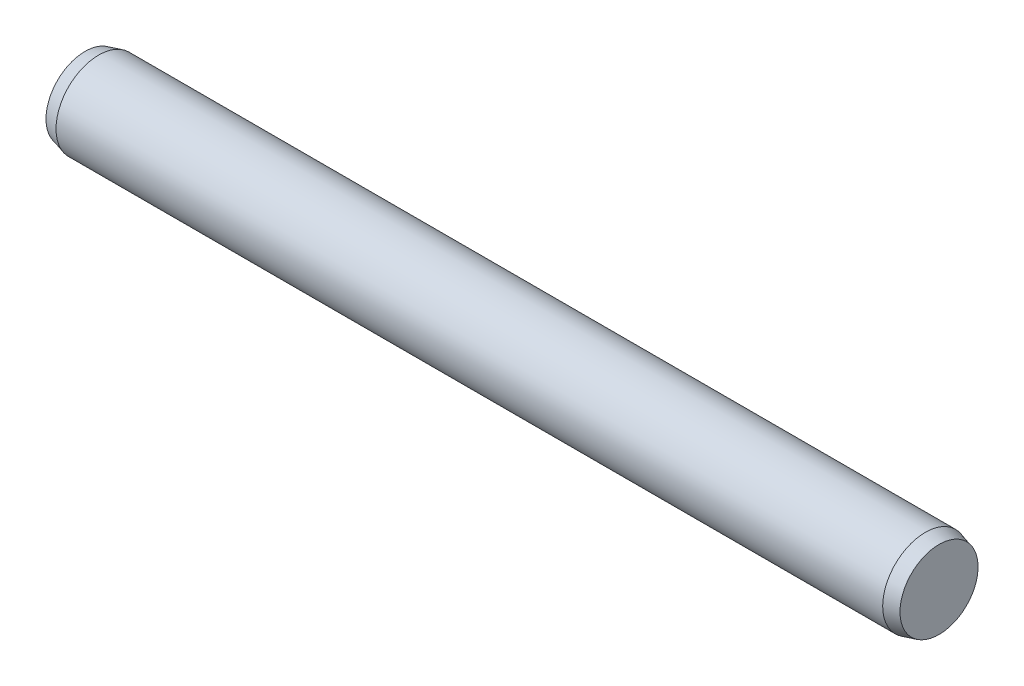
from build123d import *


with BuildPart() as part:
    # Sketch1 → Base-Revolve (revolve)
    with BuildSketch(Plane.XY, mode=Mode.PRIVATE) as base_revolve_sk:
        Polygon((0, 0), (50, 0), (50, 2.285640646), (49.2, 2.5), (0.8, 2.5), (0, 2.285640646), align=None)
    revolve(base_revolve_sk.sketch.rotate(Axis((-6.35, 0, 0), (1, 0, 0)), 90), axis=Axis((-6.35, 0, 0), (1, 0, 0)))


solid = part.part
